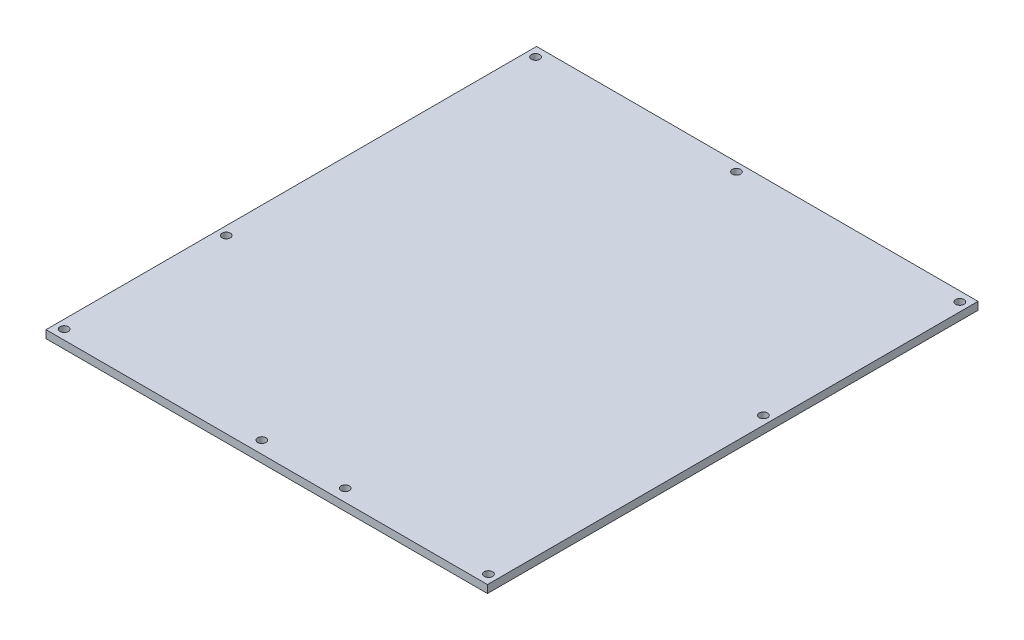
from build123d import *

# Parameters (mm, degrees)
SKETCH1_W           = 179.999999918
SKETCH1_H           = 200.00000005
SKETCH1_R           = 1.7
BOSS_EXTRUDE1_DEPTH = 3.175


with BuildPart() as part:
    # Sketch1 → Boss-Extrude1 (new body)
    with BuildSketch(Plane(origin=(0, 0, 0), x_dir=(1, 0, 0), z_dir=(0, 1, 0))):
        Rectangle(SKETCH1_W, SKETCH1_H)
        with Locations(Location((-86.499999959, 96.111111133, 0), (0, 0, 270))):
            Circle(SKETCH1_R, mode=Mode.SUBTRACT)
        with Locations(Location((-4.999999959, 96.500000025, 0), (0, 0, 270))):
            Circle(SKETCH1_R, mode=Mode.SUBTRACT)
        with Locations(Location((86.500000041, 96.111111224, 0), (0, 0, 270))):
            Circle(SKETCH1_R, mode=Mode.SUBTRACT)
        with Locations(Location((-86.499999959, -96.111111133, 0), (0, 0, 270))):
            Circle(SKETCH1_R, mode=Mode.SUBTRACT)
        with Locations(Location((-6.989999959, -95.000000025, 0), (0, 0, 270))):
            Circle(SKETCH1_R, mode=Mode.SUBTRACT)
        with Locations(Location((27.000000041, -95.000000025, 0), (0, 0, 270))):
            Circle(SKETCH1_R, mode=Mode.SUBTRACT)
        with Locations(Location((86.500000041, -96.111111224, 0), (0, 0, 270))):
            Circle(SKETCH1_R, mode=Mode.SUBTRACT)
        with Locations(Location((86.499999959, 15.999999975, 0), (0, 0, 270))):
            Circle(SKETCH1_R, mode=Mode.SUBTRACT)
        with Locations(Location((-86.499999959, -30.000000025, 0), (0, 0, 270))):
            Circle(SKETCH1_R, mode=Mode.SUBTRACT)
    extrude(amount=BOSS_EXTRUDE1_DEPTH)


solid = part.part
